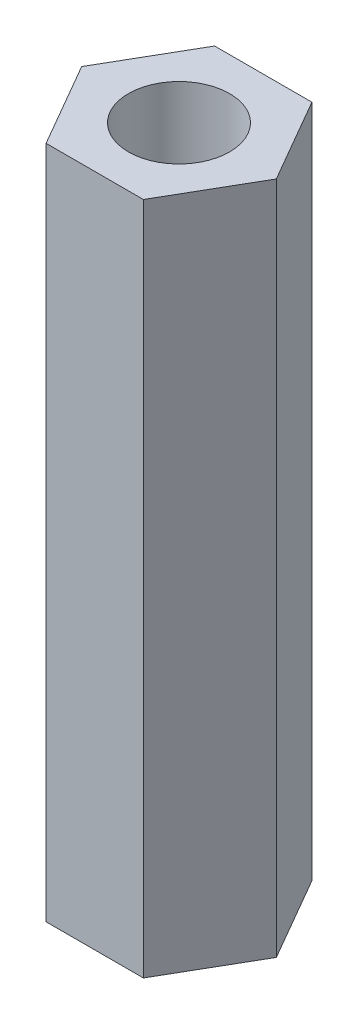
from build123d import *

# Parameters (mm, degrees)
CROQUIS1_R              = 1.5
SALIENTE_EXTRUIR1_DEPTH = 10


with BuildPart() as part:
    # Croquis1 → Saliente-Extruir1 (new, symmetric)
    with BuildSketch(Plane(origin=(0, 0, 0), x_dir=(1, 0, 0), z_dir=(0, 1, 0))):
        Polygon((1.443375673, -2.5), (2.886751346, 0), (1.443375673, 2.5), (-1.443375673, 2.5), (-2.886751346, 0), (-1.443375673, -2.5), align=None)
        with Locations(Location((0, 0, 0), (0, 0, 270))):
            Circle(CROQUIS1_R, mode=Mode.SUBTRACT)
    extrude(amount=SALIENTE_EXTRUIR1_DEPTH, both=True)


solid = part.part
